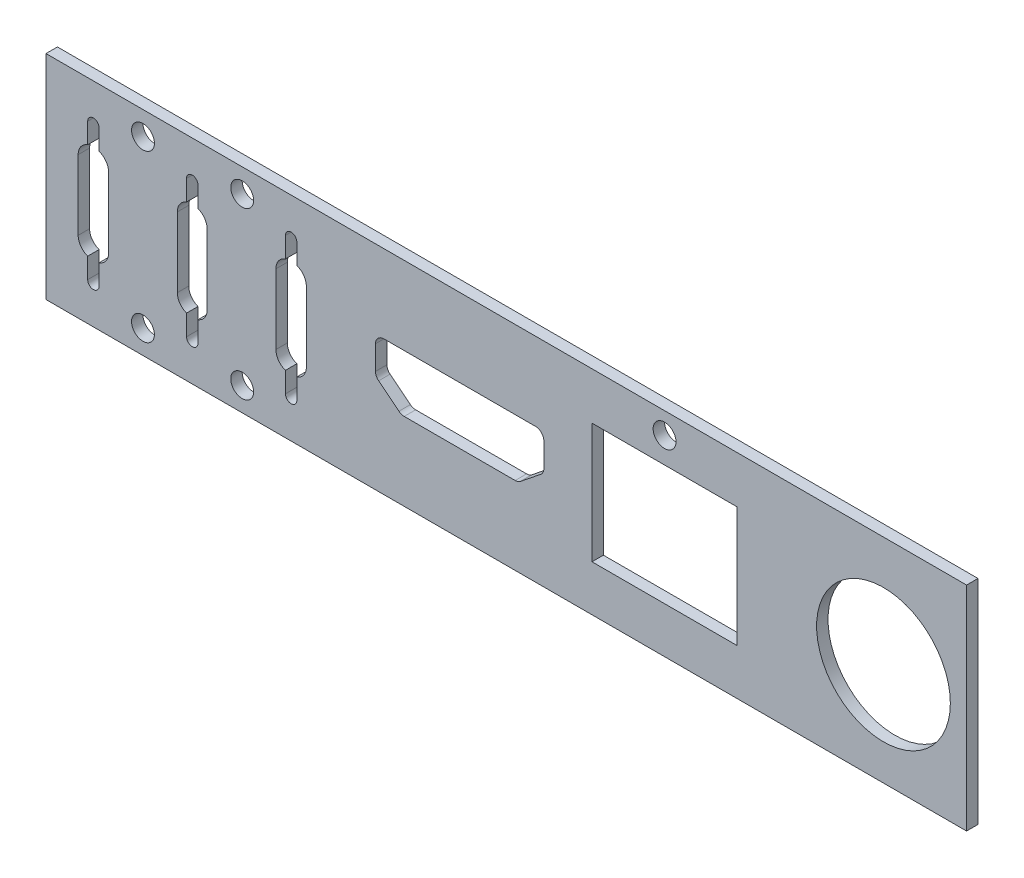
from build123d import *

# Parameters (mm, degrees)
SKETCH1_W           = 80.536494558
SKETCH1_H           = 18.639450705
SKETCH1_R           = 1
SKETCH1_W_2         = 12.7
SKETCH1_H_2         = 10.505884886
SKETCH1_R_2         = 5.85
BOSS_EXTRUDE1_DEPTH = 1


with BuildPart() as part:
    # Sketch1 → Boss-Extrude1 (new body)
    with BuildSketch(Plane.XY):
        with Locations((8.176740168, 8.08881823)):
            Rectangle(SKETCH1_W, SKETCH1_H)
        with Locations((-23.606833594, 0.85)):
            Circle(SKETCH1_R, mode=Mode.SUBTRACT)
        with Locations((-14.928531322, 0.85)):
            Circle(SKETCH1_R, mode=Mode.SUBTRACT)
        with BuildLine():
            Line((-1.215095217, 5.746392688), (-2.98864341, 7.166966689))
            ThreePointArc((-2.98864341, 7.166966689), (-3.191938605, 7.422731407), (-3.264469824, 7.741296549))
            Line((-3.264469824, 7.741296549), (-3.264469824, 9.837116478))
            ThreePointArc((-3.264469824, 9.837116478), (-3.048943677, 10.357442625), (-2.52861753, 10.572968772))
            Line((-2.52861753, 10.572968772), (10.728001089, 10.572968772))
            ThreePointArc((10.728001089, 10.572968772), (11.248327236, 10.357442625), (11.463853383, 9.837116478))
            Line((11.463853383, 9.837116478), (11.463853383, 7.741296549))
            ThreePointArc((11.463853383, 7.741296549), (11.391322164, 7.422731407), (11.188026969, 7.166966689))
            Line((11.188026969, 7.166966689), (9.414478776, 5.746392688))
            ThreePointArc((9.414478776, 5.746392688), (9.198232155, 5.626424146), (8.954452897, 5.584870255))
            Line((8.954452897, 5.584870255), (-0.755069338, 5.584870255))
            ThreePointArc((-0.755069338, 5.584870255), (-0.998848596, 5.626424146), (-1.215095217, 5.746392688))
        make_face(mode=Mode.SUBTRACT)
        with Locations((22.024917985, 8.038348308)):
            Rectangle(SKETCH1_W_2, SKETCH1_H_2, mode=Mode.SUBTRACT)
        with Locations((41.175605906, 7.741296549)):
            Circle(SKETCH1_R_2, mode=Mode.SUBTRACT)
        with BuildLine():
            Line((-27.44598473, 14.1), (-27.44598473, 12.318789547))
            ThreePointArc((-27.44598473, 12.318789547), (-26.843437597, 11.871801459), (-26.613964343, 11.157516205))
            Line((-26.613964343, 11.157516205), (-26.613964343, 5.042483795))
            ThreePointArc((-26.613964343, 5.042483795), (-26.843437597, 4.328198541), (-27.44598473, 3.881210453))
            Line((-27.44598473, 3.881210453), (-27.44598473, 2.1))
            ThreePointArc((-27.44598473, 2.1), (-27.94598473, 1.6), (-28.44598473, 2.1))
            Line((-28.44598473, 2.1), (-28.44598473, 3.881210453))
            ThreePointArc((-28.44598473, 3.881210453), (-29.048531864, 4.328198541), (-29.278005117, 5.042483795))
            Line((-29.278005117, 5.042483795), (-29.278005117, 11.157516205))
            ThreePointArc((-29.278005117, 11.157516205), (-29.048531864, 11.871801459), (-28.44598473, 12.318789547))
            Line((-28.44598473, 12.318789547), (-28.44598473, 14.1))
            ThreePointArc((-28.44598473, 14.1), (-27.94598473, 14.6), (-27.44598473, 14.1))
        make_face(mode=Mode.SUBTRACT)
        with BuildLine():
            ThreePointArc((-17.992266615, 5.042483795), (-18.213073344, 4.340452327), (-18.79598473, 3.891210622))
            Line((-18.79598473, 3.891210622), (-18.79598473, 2.1))
            ThreePointArc((-18.79598473, 2.1), (-19.29598473, 1.6), (-19.79598473, 2.1))
            Line((-19.79598473, 2.1), (-19.79598473, 3.891210622))
            ThreePointArc((-19.79598473, 3.891210622), (-20.378896116, 4.340452327), (-20.599702845, 5.042483795))
            Line((-20.599702845, 5.042483795), (-20.599702845, 11.157516205))
            ThreePointArc((-20.599702845, 11.157516205), (-20.378896116, 11.859547673), (-19.79598473, 12.308789378))
            Line((-19.79598473, 12.308789378), (-19.79598473, 14.1))
            ThreePointArc((-19.79598473, 14.1), (-19.29598473, 14.6), (-18.79598473, 14.1))
            Line((-18.79598473, 14.1), (-18.79598473, 12.308789378))
            ThreePointArc((-18.79598473, 12.308789378), (-18.213073344, 11.859547673), (-17.992266615, 11.157516205))
            Line((-17.992266615, 11.157516205), (-17.992266615, 5.042483795))
        make_face(mode=Mode.SUBTRACT)
        with BuildLine():
            Line((-10.14598473, 14.1), (-10.14598473, 12.318789547))
            ThreePointArc((-10.14598473, 12.318789547), (-9.543437597, 11.871801459), (-9.313964343, 11.157516205))
            Line((-9.313964343, 11.157516205), (-9.313964343, 5.042483795))
            ThreePointArc((-9.313964343, 5.042483795), (-9.543437597, 4.328198541), (-10.14598473, 3.881210453))
            Line((-10.14598473, 3.881210453), (-10.14598473, 2.1))
            ThreePointArc((-10.14598473, 2.1), (-10.64598473, 1.6), (-11.14598473, 2.1))
            Line((-11.14598473, 2.1), (-11.14598473, 3.881210453))
            ThreePointArc((-11.14598473, 3.881210453), (-11.748531864, 4.328198541), (-11.978005117, 5.042483795))
            Line((-11.978005117, 5.042483795), (-11.978005117, 11.157516205))
            ThreePointArc((-11.978005117, 11.157516205), (-11.748531864, 11.871801459), (-11.14598473, 12.318789547))
            Line((-11.14598473, 12.318789547), (-11.14598473, 14.1))
            ThreePointArc((-11.14598473, 14.1), (-10.64598473, 14.6), (-10.14598473, 14.1))
        make_face(mode=Mode.SUBTRACT)
        with Locations((-23.606833594, 15.35)):
            Circle(SKETCH1_R, mode=Mode.SUBTRACT)
        with Locations((-14.928531322, 15.35)):
            Circle(SKETCH1_R, mode=Mode.SUBTRACT)
        with Locations((22.024917985, 15.541290751)):
            Circle(SKETCH1_R, mode=Mode.SUBTRACT)
    extrude(amount=BOSS_EXTRUDE1_DEPTH)


solid = part.part
